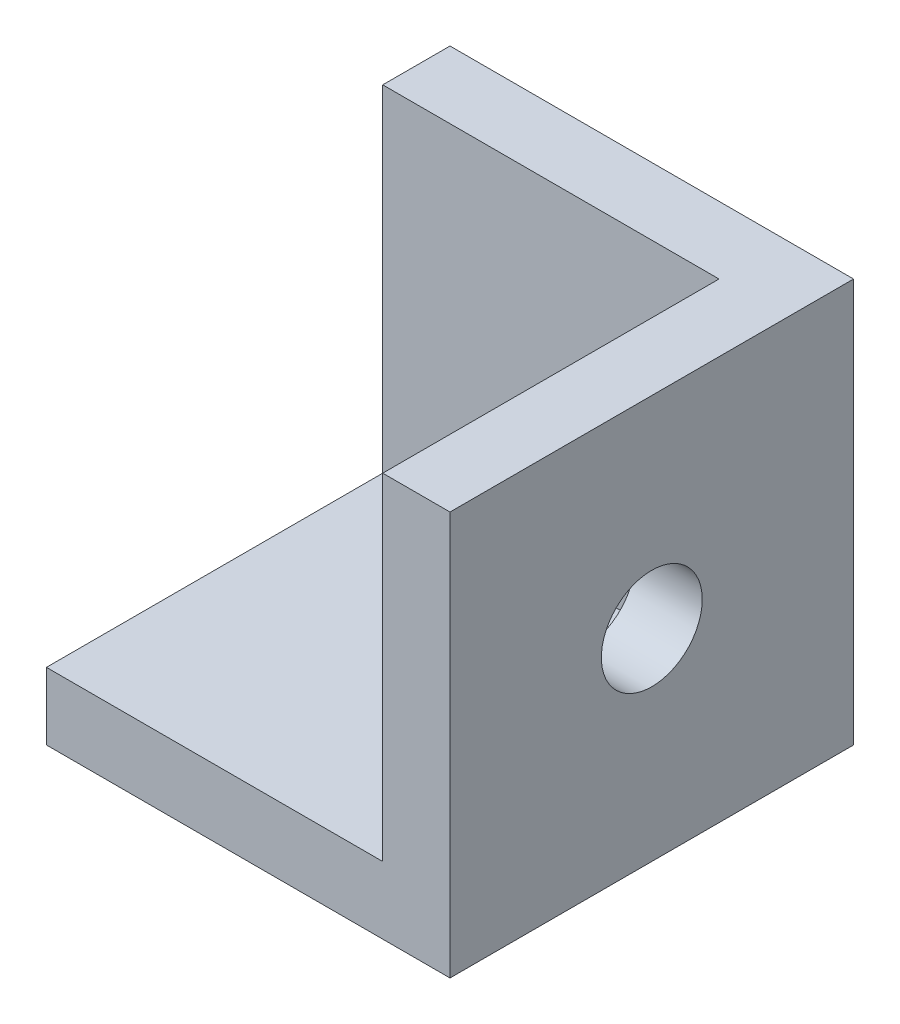
from build123d import *

# Parameters (mm, degrees)
BOSS_EXTRUDE1_DEPTH = 19.05
SKETCH3_W           = 19.05
SKETCH3_H           = 19.05
BOSS_EXTRUDE2_DEPTH = 3.175
SKETCH4_R           = 2.38125
CUT_EXTRUDE1_DEPTH  = 33.995567884


with BuildPart() as part:
    # Sketch2 → Boss-Extrude1 (new body)
    with BuildSketch(Plane(origin=(0, 0, 0), x_dir=(0, 0, -1), z_dir=(1, 0, 0))):
        Polygon((0, 0), (0, 19.05), (-3.175, 19.05), (-3.175, 3.175), (-19.05, 3.175), (-19.05, 0), align=None)
    extrude(amount=BOSS_EXTRUDE1_DEPTH)

    # Sketch3 → Boss-Extrude2 (add)
    with BuildSketch(Plane(origin=(19.05, 0, 0), x_dir=(0, 0, -1), z_dir=(1, 0, 0))):
        with Locations((-9.525, 9.525)):
            Rectangle(SKETCH3_W, SKETCH3_H)
    extrude(amount=-BOSS_EXTRUDE2_DEPTH)

    # Sketch4 → Cut-Extrude1 (cut, through all)
    with BuildSketch(Plane(origin=(19.05, 0, 0), x_dir=(0, 0, -1), z_dir=(1, 0, 0))):
        with Locations((-9.525, 9.525)):
            Circle(SKETCH4_R)
    extrude(amount=-CUT_EXTRUDE1_DEPTH, mode=Mode.SUBTRACT)


solid = part.part
